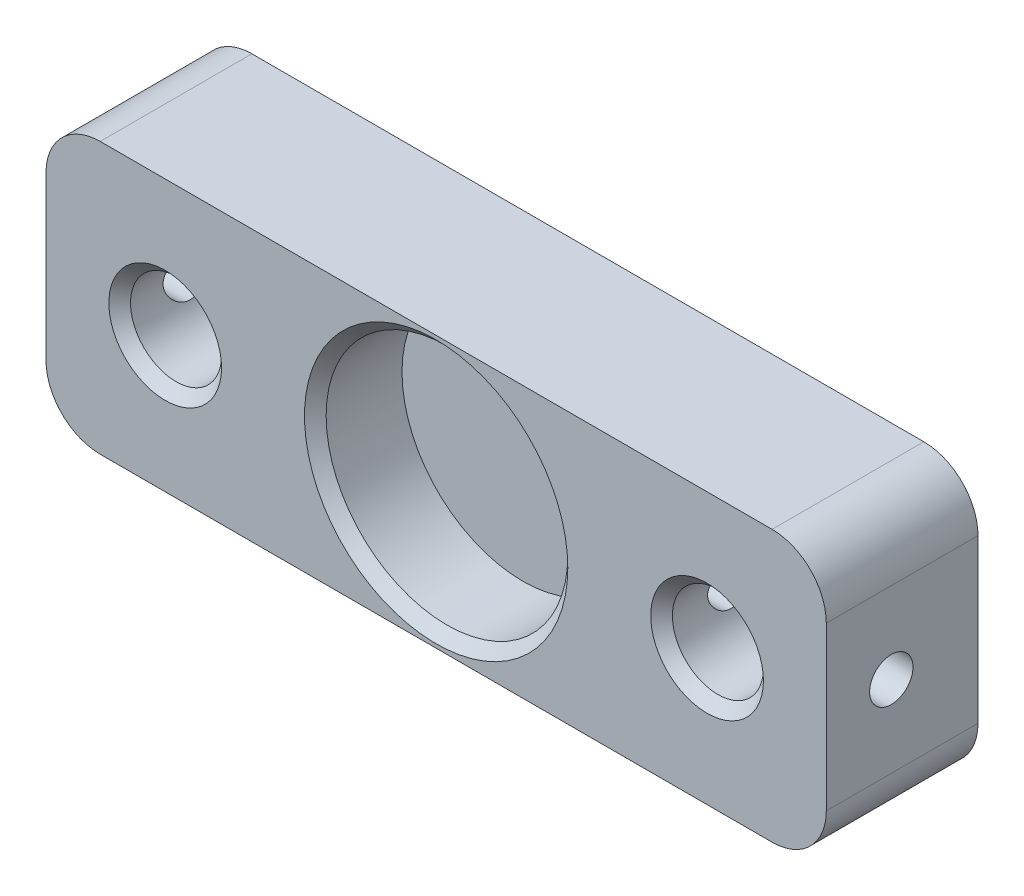
from build123d import *

# Parameters (mm, degrees)
SKETCH1_W               = 72
SKETCH1_H               = 25
BOSS_EXTRUDE1_DEPTH     = 14
SKETCH2_R               = 11.15
CUT_EXTRUDE1_DEPTH      = 8
SKETCH3_R               = 4.2
CUT_EXTRUDE2_DEPTH      = 12
CUT_EXTRUDE3_REACH      = 76.406
CUT_EXTRUDE3_END_RADIUS = 4.2
SKETCH6_R               = 2
ZAOKR_GLENIE1_R         = 5
SFAZOWANIE1_SIZE        = 1


with BuildPart() as part:
    # Sketch1 → Boss-Extrude1 (new body)
    with BuildSketch(Plane.XY):
        Rectangle(SKETCH1_W, SKETCH1_H)
    extrude(amount=BOSS_EXTRUDE1_DEPTH)

    # Sketch2 → Cut-Extrude1 (cut)
    with BuildSketch(Plane.XY.offset(14)):
        Circle(SKETCH2_R)
    extrude(amount=-CUT_EXTRUDE1_DEPTH, mode=Mode.SUBTRACT)

    # Sketch3 → Cut-Extrude2 (cut)
    with BuildSketch(Plane.XY.offset(14)):
        with Locations((-25, 0)):
            Circle(SKETCH3_R)
        with Locations((25, 0)):
            Circle(SKETCH3_R)
    extrude(amount=-CUT_EXTRUDE2_DEPTH, mode=Mode.SUBTRACT)

    # Sketch5 → Ø3.5 (3.5) Diameter Hole1 (revolve, cut)
    with BuildSketch(Plane(origin=(-36, 0, 8), x_dir=(0, 0, 1), z_dir=(0, 1, 0))):
        Polygon((0, 0), (0, 21.051506083), (1.75, 20), (1.75, 0), align=None)
    f_3_5_3_5_diameter_hole1 = revolve(axis=Axis((-42.35, 0, 8), (1, 0, 0)), mode=Mode.SUBTRACT)

    # Cut-Extrude3: up to this cylinder (the profile starts outside it)
    cut_extrude3_end = Plane(origin=(-25, 0, 8), z_dir=(0, 0, 1)) * Cylinder(CUT_EXTRUDE3_END_RADIUS, 162.212, mode=Mode.PRIVATE)
    # Sketch6 → Cut-Extrude3 (cut, up to the surface)
    with BuildSketch(Plane.ZY.offset(36), mode=Mode.PRIVATE) as cut_extrude3_sk1:
        with Locations(Location((8, 0, 0), (0, 0, 270))):
            Circle(SKETCH6_R)
    cut_extrude3_tool1 = extrude(cut_extrude3_sk1.sketch, amount=-CUT_EXTRUDE3_REACH, mode=Mode.PRIVATE) - cut_extrude3_end
    cut_extrude3 = cut_extrude3_tool1.solids().sort_by_distance((-36, 0, 8))[0]
    add(cut_extrude3, mode=Mode.SUBTRACT)

    # Mirror1: Ø3.5 (3.5) Diameter Hole1, Cut-Extrude3 across plane
    add(f_3_5_3_5_diameter_hole1.mirror(Plane(origin=(0, 0, 0), x_dir=(0, 0, 1), z_dir=(1, 0, 0))), mode=Mode.SUBTRACT)
    add(cut_extrude3.mirror(Plane(origin=(0, 0, 0), x_dir=(0, 0, 1), z_dir=(1, 0, 0))), mode=Mode.SUBTRACT)

    # Zaokrąglenie1
    zaokr_glenie1_edges = [part.edges().sort_by_distance(p)[0] for p in [
        (-36, 12.5, 7),
        (36, 12.5, 7),
        (36, -12.5, 7),
        (-36, -12.5, 7),
    ]]
    fillet(zaokr_glenie1_edges, radius=ZAOKR_GLENIE1_R)

    # Sfazowanie1
    sfazowanie1_edges = [part.edges().sort_by_distance(p)[0] for p in [
        (-11.15, 0, 14),
        (-29.2, 0, 14),
        (20.8, 0, 14),
    ]]
    chamfer(sfazowanie1_edges, length=SFAZOWANIE1_SIZE)


solid = part.part
